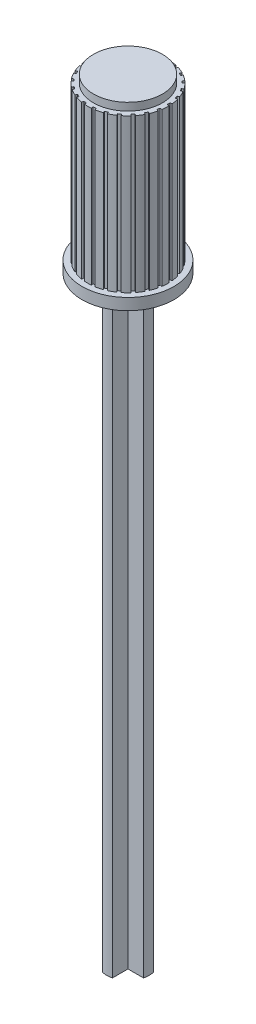
from build123d import *

# Parameters (mm, degrees)
BOSS_EXTRUDE2_DEPTH = 39
SKETCH5_R           = 3
BOSS_EXTRUDE3_DEPTH = 0.75
BOSS_EXTRUDE5_DEPTH = 10
SKETCH10_R          = 2.25
BOSS_EXTRUDE6_DEPTH = 0.5


with BuildPart() as part:
    # Sketch4 → Boss-Extrude2 (new body)
    with BuildSketch(Plane(origin=(0, 0, 0), x_dir=(1, 0, 0), z_dir=(0, 1, 0))):
        with BuildLine():
            Line((-0.32, 1.337245303), (-0.32, 0.32))
            Line((-0.32, 0.32), (-1.337245303, 0.32))
            ThreePointArc((-1.337245303, 0.32), (-1.375, 0), (-1.337245303, -0.32))
            Line((-1.337245303, -0.32), (-0.32, -0.32))
            Line((-0.32, -0.32), (-0.32, -1.337245303))
            ThreePointArc((-0.32, -1.337245303), (0, -1.375), (0.32, -1.337245303))
            Line((0.32, -1.337245303), (0.32, -0.32))
            Line((0.32, -0.32), (1.337245303, -0.32))
            ThreePointArc((1.337245303, -0.32), (1.375, 0), (1.337245303, 0.32))
            Line((1.337245303, 0.32), (0.32, 0.32))
            Line((0.32, 0.32), (0.32, 1.337245303))
            ThreePointArc((0.32, 1.337245303), (0, 1.375), (-0.32, 1.337245303))
        make_face()
    extrude(amount=BOSS_EXTRUDE2_DEPTH)

    # Sketch5 → Boss-Extrude3 (add)
    with BuildSketch(Plane(origin=(0, 39, 0), x_dir=(1, 0, 0), z_dir=(0, 1, 0))):
        with Locations(Location((0, 0, 0), (0, 0, 270))):
            Circle(SKETCH5_R)
    extrude(amount=BOSS_EXTRUDE3_DEPTH)

    # Sketch9 → Boss-Extrude5 (add)
    with BuildSketch(Plane(origin=(0, 39.75, 0), x_dir=(1, 0, 0), z_dir=(0, 1, 0))):
        with BuildLine():
            Line((-0.83040283, -2.358056645), (-0.873204905, -2.479599724))
            ThreePointArc((-0.873204905, -2.479599724), (-0.653770741, -2.546268921), (-0.429360987, -2.593559473))
            Line((-0.429360987, -2.593559473), (-0.408314906, -2.466430404))
            ThreePointArc((-0.408314906, -2.466430404), (-0.313333084, -2.480286753), (-0.217889357, -2.490486745))
            Line((-0.217889357, -2.490486745), (-0.229120191, -2.618855769))
            ThreePointArc((-0.229120191, -2.618855769), (0, -2.628859372), (0.229120191, -2.618855769))
            Line((0.229120191, -2.618855769), (0.217889357, -2.490486745))
            ThreePointArc((0.217889357, -2.490486745), (0.313333084, -2.480286753), (0.408314906, -2.466430404))
            Line((0.408314906, -2.466430404), (0.429360987, -2.593559473))
            ThreePointArc((0.429360987, -2.593559473), (0.653770741, -2.546268921), (0.873204905, -2.479599724))
            Line((0.873204905, -2.479599724), (0.83040283, -2.358056645))
            ThreePointArc((0.83040283, -2.358056645), (0.920311382, -2.324441215), (1.008863241, -2.28739917))
            Line((1.008863241, -2.28739917), (1.060863834, -2.405300298))
            ThreePointArc((1.060863834, -2.405300298), (1.266462661, -2.303687029), (1.462422943, -2.18454131))
            Line((1.462422943, -2.18454131), (1.390739039, -2.077461173))
            ThreePointArc((1.390739039, -2.077461173), (1.469463131, -2.022542486), (1.546020988, -1.964642233))
            Line((1.546020988, -1.964642233), (1.625708706, -2.065907259))
            ThreePointArc((1.625708706, -2.065907259), (1.799578075, -1.916356008), (1.959751569, -1.752220131))
            Line((1.959751569, -1.752220131), (1.863689999, -1.666331176))
            ThreePointArc((1.863689999, -1.666331176), (1.926283107, -1.593559974), (1.986036551, -1.518439599))
            Line((1.986036551, -1.518439599), (2.088404321, -1.596705669))
            ThreePointArc((2.088404321, -1.596705669), (2.21961938, -1.408613292), (2.333941796, -1.209800517))
            Line((2.333941796, -1.209800517), (2.219538463, -1.150499462))
            ThreePointArc((2.219538463, -1.150499462), (2.262067631, -1.064448229), (2.301262134, -0.976827821))
            Line((2.301262134, -0.976827821), (2.419877811, -1.027177189))
            ThreePointArc((2.419877811, -1.027177189), (2.500193836, -0.812362222), (2.561481877, -0.591364688))
            Line((2.561481877, -0.591364688), (2.435925162, -0.562377636))
            ThreePointArc((2.435925162, -0.562377636), (2.455718127, -0.468453286), (2.471890953, -0.373838359))
            Line((2.471890953, -0.373838359), (2.599301479, -0.393107389))
            ThreePointArc((2.599301479, -0.393107389), (2.623671919, -0.165067446), (2.628074631, 0.064228761))
            Line((2.628074631, 0.064228761), (2.499253724, 0.061080445))
            ThreePointArc((2.499253724, 0.061080445), (2.495066821, 0.156976299), (2.487201772, 0.252640743))
            Line((2.487201772, 0.252640743), (2.615401476, 0.265662794))
            ThreePointArc((2.615401476, 0.265662794), (2.582295045, 0.492599125), (2.52953579, 0.715786479))
            Line((2.52953579, 0.715786479), (2.405544984, 0.680700618))
            ThreePointArc((2.405544984, 0.680700618), (2.377641291, 0.772542486), (2.346232557, 0.863245497))
            Line((2.346232557, 0.863245497), (2.467166179, 0.907740407))
            ThreePointArc((2.467166179, 0.907740407), (2.378663077, 1.119313881), (2.272056913, 1.322368701))
            Line((2.272056913, 1.322368701), (2.160687005, 1.257549867))
            ThreePointArc((2.160687005, 1.257549867), (2.110819814, 1.339566987), (2.057840921, 1.419609363))
            Line((2.057840921, 1.419609363), (2.163909757, 1.492781351))
            ThreePointArc((2.163909757, 1.492781351), (2.02557096, 1.67569803), (1.871816344, 1.845861634))
            Line((1.871816344, 1.845861634), (1.780065115, 1.755382632))
            ThreePointArc((1.780065115, 1.755382632), (1.711367765, 1.822421569), (1.640147572, 1.886773951))
            Line((1.640147572, 1.886773951), (1.724686927, 1.984025353))
            ThreePointArc((1.724686927, 1.984025353), (1.545204769, 2.126791908), (1.35396267, 2.253372292))
            Line((1.35396267, 2.253372292), (1.287595187, 2.142918252))
            ThreePointArc((1.287595187, 2.142918252), (1.204384185, 2.1907667), (1.11939772, 2.235385592))
            Line((1.11939772, 2.235385592), (1.177095675, 2.350605746))
            ThreePointArc((1.177095675, 2.350605746), (0.96774768, 2.444251629), (0.751034542, 2.519295281))
            Line((0.751034542, 2.519295281), (0.714220919, 2.395806436))
            ThreePointArc((0.714220919, 2.395806436), (0.621724718, 2.421457903), (0.528311991, 2.443539736))
            Line((0.528311991, 2.443539736), (0.555543172, 2.569488934))
            ThreePointArc((0.555543172, 2.569488934), (0.329483446, 2.608130031), (0.100916152, 2.626921683))
            Line((0.100916152, 2.626921683), (0.095969523, 2.498157291))
            ThreePointArc((0.095969523, 2.498157291), (0, 2.5), (-0.095969523, 2.498157291))
            Line((-0.095969523, 2.498157291), (-0.100916152, 2.626921683))
            ThreePointArc((-0.100916152, 2.626921683), (-0.329483446, 2.608130031), (-0.555543172, 2.569488934))
            Line((-0.555543172, 2.569488934), (-0.528311991, 2.443539736))
            ThreePointArc((-0.528311991, 2.443539736), (-0.621724718, 2.421457903), (-0.714220919, 2.395806436))
            Line((-0.714220919, 2.395806436), (-0.751034542, 2.519295281))
            ThreePointArc((-0.751034542, 2.519295281), (-0.96774768, 2.444251629), (-1.177095675, 2.350605746))
            Line((-1.177095675, 2.350605746), (-1.11939772, 2.235385592))
            ThreePointArc((-1.11939772, 2.235385592), (-1.204384185, 2.1907667), (-1.287595187, 2.142918252))
            Line((-1.287595187, 2.142918252), (-1.35396267, 2.253372292))
            ThreePointArc((-1.35396267, 2.253372292), (-1.545204769, 2.126791908), (-1.724686927, 1.984025353))
            Line((-1.724686927, 1.984025353), (-1.640147572, 1.886773951))
            ThreePointArc((-1.640147572, 1.886773951), (-1.711367765, 1.822421569), (-1.780065115, 1.755382632))
            Line((-1.780065115, 1.755382632), (-1.871816344, 1.845861634))
            ThreePointArc((-1.871816344, 1.845861634), (-2.02557096, 1.67569803), (-2.163909757, 1.492781351))
            Line((-2.163909757, 1.492781351), (-2.057840921, 1.419609363))
            ThreePointArc((-2.057840921, 1.419609363), (-2.110819814, 1.339566987), (-2.160687005, 1.257549867))
            Line((-2.160687005, 1.257549867), (-2.272056913, 1.322368701))
            ThreePointArc((-2.272056913, 1.322368701), (-2.378663077, 1.119313881), (-2.467166179, 0.907740407))
            Line((-2.467166179, 0.907740407), (-2.346232557, 0.863245497))
            ThreePointArc((-2.346232557, 0.863245497), (-2.377641291, 0.772542486), (-2.405544984, 0.680700618))
            Line((-2.405544984, 0.680700618), (-2.52953579, 0.715786479))
            ThreePointArc((-2.52953579, 0.715786479), (-2.582295045, 0.492599125), (-2.615401476, 0.265662794))
            Line((-2.615401476, 0.265662794), (-2.487201772, 0.252640743))
            ThreePointArc((-2.487201772, 0.252640743), (-2.495066821, 0.156976299), (-2.499253724, 0.061080445))
            Line((-2.499253724, 0.061080445), (-2.628074631, 0.064228761))
            ThreePointArc((-2.628074631, 0.064228761), (-2.623671919, -0.165067446), (-2.599301479, -0.393107389))
            Line((-2.599301479, -0.393107389), (-2.471890953, -0.373838359))
            ThreePointArc((-2.471890953, -0.373838359), (-2.455718127, -0.468453286), (-2.435925162, -0.562377636))
            Line((-2.435925162, -0.562377636), (-2.561481877, -0.591364688))
            ThreePointArc((-2.561481877, -0.591364688), (-2.500193836, -0.812362222), (-2.419877811, -1.027177189))
            Line((-2.419877811, -1.027177189), (-2.301262134, -0.976827821))
            ThreePointArc((-2.301262134, -0.976827821), (-2.262067631, -1.064448229), (-2.219538463, -1.150499462))
            Line((-2.219538463, -1.150499462), (-2.333941796, -1.209800517))
            ThreePointArc((-2.333941796, -1.209800517), (-2.21961938, -1.408613292), (-2.088404321, -1.596705669))
            Line((-2.088404321, -1.596705669), (-1.986036551, -1.518439599))
            ThreePointArc((-1.986036551, -1.518439599), (-1.926283107, -1.593559974), (-1.863689999, -1.666331176))
            Line((-1.863689999, -1.666331176), (-1.959751569, -1.752220131))
            ThreePointArc((-1.959751569, -1.752220131), (-1.799578075, -1.916356008), (-1.625708706, -2.065907259))
            Line((-1.625708706, -2.065907259), (-1.546020988, -1.964642233))
            ThreePointArc((-1.546020988, -1.964642233), (-1.469463131, -2.022542486), (-1.390739039, -2.077461173))
            Line((-1.390739039, -2.077461173), (-1.462422943, -2.18454131))
            ThreePointArc((-1.462422943, -2.18454131), (-1.266462661, -2.303687029), (-1.060863834, -2.405300298))
            Line((-1.060863834, -2.405300298), (-1.008863241, -2.28739917))
            ThreePointArc((-1.008863241, -2.28739917), (-0.920311382, -2.324441215), (-0.83040283, -2.358056645))
        make_face()
    extrude(amount=BOSS_EXTRUDE5_DEPTH)

    # Sketch10 → Boss-Extrude6 (add)
    with BuildSketch(Plane(origin=(0, 49.75, 0), x_dir=(1, 0, 0), z_dir=(0, 1, 0))):
        with Locations(Location((0, 0, 0), (0, 0, 270))):
            Circle(SKETCH10_R)
    extrude(amount=BOSS_EXTRUDE6_DEPTH)


solid = part.part
